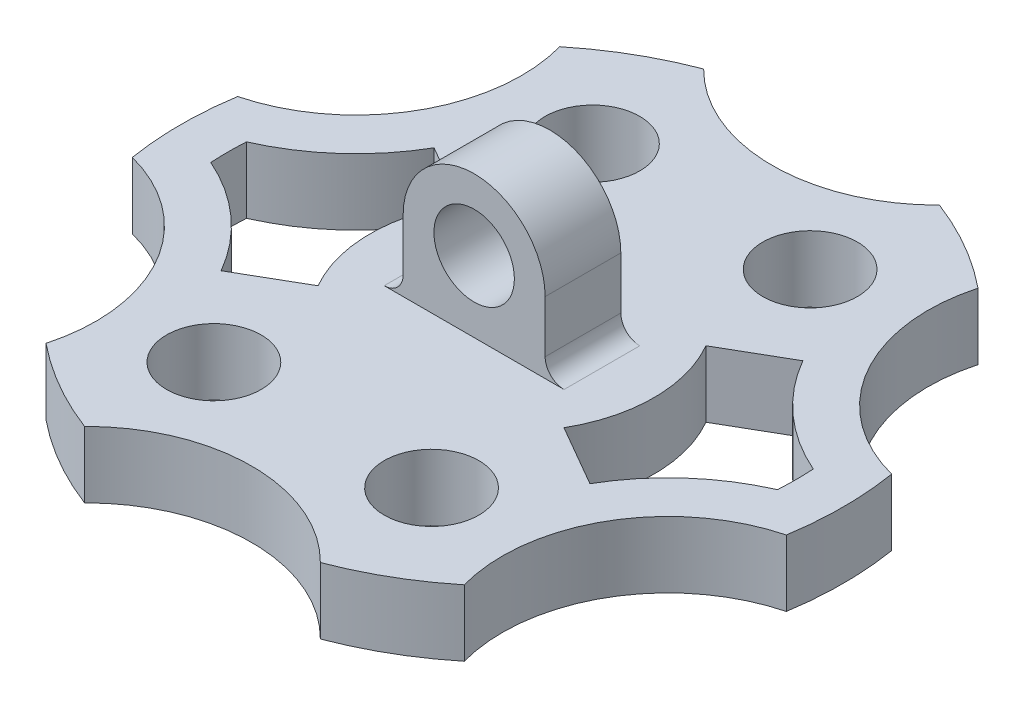
from build123d import *

# Parameters (mm, degrees)
SKETCH1_R                  = 35
BOSS_EXTRUDE1_DEPTH        = 7
SKETCH2_R                  = 17.5
CUT_EXTRUDE1_DEPTH         = 50.989999
CIRPATTERN1_COUNT          = 6
F_10_0_10_DIAMETER_HOLE1_D = 10
LPATTERN1_COUNT            = 2
LPATTERN1_PITCH            = 23
LPATTERN1_COUNT_DIR2       = 2
LPATTERN1_PITCH_DIR2       = 40
CUT_EXTRUDE2_DEPTH         = 49.413170413
SKETCH11_W                 = 15
SKETCH11_H                 = 8
BOSS_EXTRUDE2_DEPTH        = 22
FILLET1_RADIUS             = 7.5
FILLET1_LENGTH             = 8
M10_TAPPED_HOLE1_D         = 8.5
FILLET2_R                  = 2


with BuildPart() as part:
    # Sketch1 → Boss-Extrude1 (new body)
    with BuildSketch(Plane(origin=(0, 0, 0), x_dir=(1, 0, 0), z_dir=(0, 1, 0))):
        with Locations(Location((0, 0, 0), (0, 0, 270))):
            Circle(SKETCH1_R)
    extrude(amount=BOSS_EXTRUDE1_DEPTH)

    # Sketch2 → Cut-Extrude1 (cut, through all)
    with BuildSketch(Plane(origin=(0, 7, 0), x_dir=(1, 0, 0), z_dir=(0, 1, 0))):
        with Locations((0, 45)):
            Circle(SKETCH2_R)
    cut_extrude1 = extrude(amount=-CUT_EXTRUDE1_DEPTH, mode=Mode.SUBTRACT)

    # CirPattern1: Cut-Extrude1 ×6 about axis
    cirpattern1_axis = Axis((0, 0, 0), (0, 1, 0))
    for i in range(1, CIRPATTERN1_COUNT):
        add(cut_extrude1.rotate(cirpattern1_axis, i * 360 / CIRPATTERN1_COUNT), mode=Mode.SUBTRACT)

    # Ø10.0 (10) Diameter Hole1 (through all)
    with Locations(Plane(origin=(0, 7, 0), x_dir=(1, 0, 0), z_dir=(0, 1, 0))):
        with Locations((-11.5, 20)):
            f_10_0_10_diameter_hole1 = Hole(F_10_0_10_DIAMETER_HOLE1_D / 2)

    # LPattern1: 10.0 _10_ Diameter Hole1 2 × 2
    with Locations(*[(i * LPATTERN1_PITCH, 0, j * LPATTERN1_PITCH_DIR2) for i in range(LPATTERN1_COUNT) for j in range(LPATTERN1_COUNT_DIR2) if (i, j) != (0, 0)]):
        add(f_10_0_10_diameter_hole1, mode=Mode.SUBTRACT)

    # Sketch9 → Cut-Extrude2 (cut, through all)
    with BuildSketch(Plane(origin=(0, 7, 0), x_dir=(1, 0, 0), z_dir=(0, 1, 0))):
        with BuildLine():
            Line((12.990381057, -7.5), (19.485571585, -11.25))
            ThreePointArc((19.485571585, -11.25), (23.964805416, -5.735160985), (29.940285542, -1.891904249))
            ThreePointArc((29.940285542, -1.891904249), (30, 0), (29.940285542, 1.891904249))
            ThreePointArc((29.940285542, 1.891904249), (23.964805416, 5.735160985), (19.485571585, 11.25))
            Line((19.485571585, 11.25), (12.990381057, 7.5))
            ThreePointArc((12.990381057, 7.5), (15, 0), (12.990381057, -7.5))
        make_face()
    cut_extrude2 = extrude(amount=-CUT_EXTRUDE2_DEPTH, mode=Mode.SUBTRACT)

    # Mirror1: Cut-Extrude2 across plane
    add(cut_extrude2.mirror(Plane(origin=(0, 0, 0), x_dir=(0, 0, 1), z_dir=(1, 0, 0))), mode=Mode.SUBTRACT)

    # Sketch11 → Boss-Extrude2 (add)
    with BuildSketch(Plane(origin=(0, 0, 0), x_dir=(1, 0, 0), z_dir=(0, 1, 0))):
        Rectangle(SKETCH11_W, SKETCH11_H)
    extrude(amount=BOSS_EXTRUDE2_DEPTH)

    # Fillet1: full round fillet: the end face becomes a half cylinder, R = half its width
    fillet1_face = Plane((0, 22, 0), x_dir=(0, 0, -1), z_dir=(0, 1, 0))  # on the end face: x along it, z out of the body
    fillet1_slab = fillet1_face.offset(-FILLET1_RADIUS / 2) * Box(FILLET1_LENGTH, 2 * FILLET1_RADIUS, FILLET1_RADIUS, mode=Mode.PRIVATE)  # the body's end, R deep
    fillet1_round = Plane((0, 14.5, 0), x_dir=(0, 1, 0), z_dir=(0, 0, -1)) * Cylinder(FILLET1_RADIUS, FILLET1_LENGTH, mode=Mode.PRIVATE)  # its axis R under the face
    add(fillet1_slab - fillet1_round, mode=Mode.SUBTRACT)

    # M10 Tapped Hole1 (through all)
    with Locations(Plane.XY.offset(4)):
        with Locations((0, 14.5)):
            Hole(M10_TAPPED_HOLE1_D / 2)

    # Fillet2
    fillet2_edges = [part.edges().sort_by_distance(p)[0] for p in [
        (7.5, 7, 0),
        (-7.5, 7, 0),
    ]]
    fillet(fillet2_edges, radius=FILLET2_R)


solid = part.part
